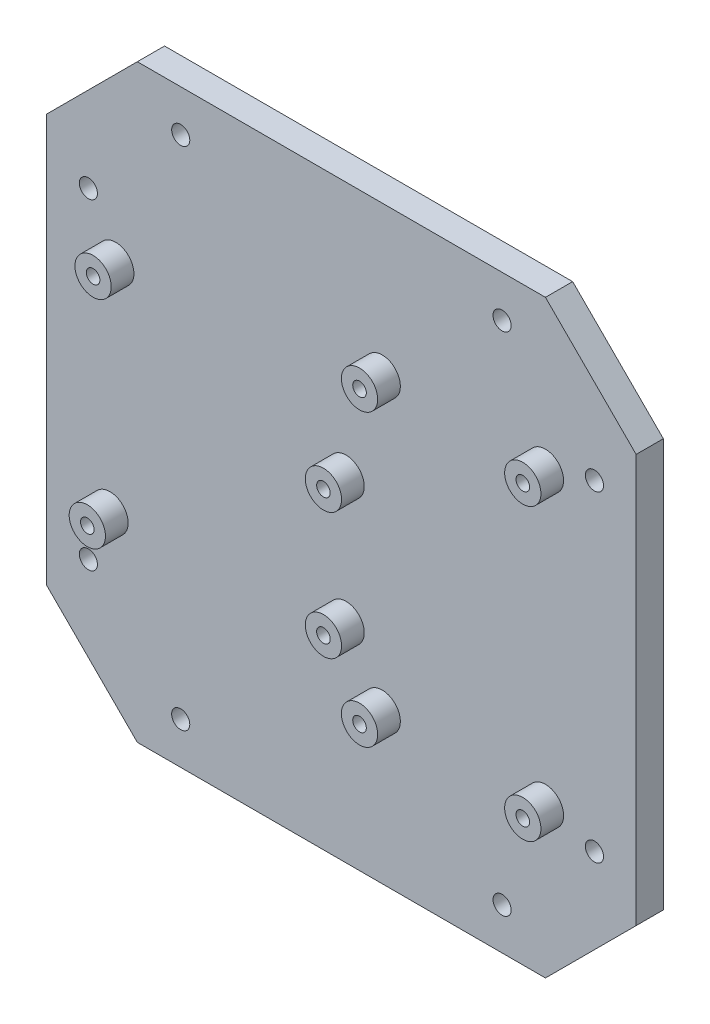
from build123d import *

# Parameters (mm, degrees)
SKETCH_1_W          = 130
SKETCH_1_H          = 130
EXTRUDE_1_DEPTH     = 6
SKETCH_10_R         = 1.5
CUT_EXTRUDE_1_DEPTH = 6
CUT_EXTRUDE_2_REACH = 185.946
SKETCH_11_R         = 2
CHAMFER_1_SIZE      = 20
CUT_EXTRUDE_3_REACH = 185.946
SKETCH_12_R         = 1.5
EXTRUDE_START       = 5
SKETCH_13_R         = 4
SKETCH_13_R_2       = 1.5
EXTRUDE_2_DEPTH     = 5


with BuildPart() as part:
    # 草圖1 → 填料-伸長1 (new body)
    with BuildSketch(Plane.XY):
        with Locations((-65, 65)):
            Rectangle(SKETCH_1_W, SKETCH_1_H)
    extrude(amount=EXTRUDE_1_DEPTH)

    # 草圖10 → 除料-伸長1 (cut)
    with BuildSketch(Plane.XY.offset(6)):
        with Locations((-114.76, 89.13)):
            Circle(SKETCH_10_R)
        with Locations((-63.96, 73.89)):
            Circle(SKETCH_10_R)
        with Locations((-63.96, 45.95)):
            Circle(SKETCH_10_R)
        with Locations((-116.03, 40.87)):
            Circle(SKETCH_10_R)
    extrude(amount=-CUT_EXTRUDE_1_DEPTH, mode=Mode.SUBTRACT)

    # 草圖11 → 除料-伸長2 (cut, up to next)
    with BuildSketch(Plane.XY.offset(6), mode=Mode.PRIVATE) as cut_extrude_2_sk1:
        with Locations((-9.2, 100.435324702)):
            Circle(SKETCH_11_R)
    cut_extrude_2_tool1 = extrude(cut_extrude_2_sk1.sketch, amount=-CUT_EXTRUDE_2_REACH, mode=Mode.PRIVATE) & part.part
    # 草圖11 → 除料-伸長2 (cut, up to next)
    with BuildSketch(Plane.XY.offset(6), mode=Mode.PRIVATE) as cut_extrude_2_sk2:
        with Locations((-29.564675298, 120.8)):
            Circle(SKETCH_11_R)
    cut_extrude_2_tool2 = extrude(cut_extrude_2_sk2.sketch, amount=-CUT_EXTRUDE_2_REACH, mode=Mode.PRIVATE) & part.part
    # 草圖11 → 除料-伸長2 (cut, up to next)
    with BuildSketch(Plane.XY.offset(6), mode=Mode.PRIVATE) as cut_extrude_2_sk3:
        with Locations((-100.435324702, 120.8)):
            Circle(SKETCH_11_R)
    cut_extrude_2_tool3 = extrude(cut_extrude_2_sk3.sketch, amount=-CUT_EXTRUDE_2_REACH, mode=Mode.PRIVATE) & part.part
    # 草圖11 → 除料-伸長2 (cut, up to next)
    with BuildSketch(Plane.XY.offset(6), mode=Mode.PRIVATE) as cut_extrude_2_sk4:
        with Locations((-120.8, 100.435324702)):
            Circle(SKETCH_11_R)
    cut_extrude_2_tool4 = extrude(cut_extrude_2_sk4.sketch, amount=-CUT_EXTRUDE_2_REACH, mode=Mode.PRIVATE) & part.part
    # 草圖11 → 除料-伸長2 (cut, up to next)
    with BuildSketch(Plane.XY.offset(6), mode=Mode.PRIVATE) as cut_extrude_2_sk5:
        with Locations((-120.8, 29.564675298)):
            Circle(SKETCH_11_R)
    cut_extrude_2_tool5 = extrude(cut_extrude_2_sk5.sketch, amount=-CUT_EXTRUDE_2_REACH, mode=Mode.PRIVATE) & part.part
    # 草圖11 → 除料-伸長2 (cut, up to next)
    with BuildSketch(Plane.XY.offset(6), mode=Mode.PRIVATE) as cut_extrude_2_sk6:
        with Locations((-100.435324702, 9.2)):
            Circle(SKETCH_11_R)
    cut_extrude_2_tool6 = extrude(cut_extrude_2_sk6.sketch, amount=-CUT_EXTRUDE_2_REACH, mode=Mode.PRIVATE) & part.part
    # 草圖11 → 除料-伸長2 (cut, up to next)
    with BuildSketch(Plane.XY.offset(6), mode=Mode.PRIVATE) as cut_extrude_2_sk7:
        with Locations((-29.564675298, 9.2)):
            Circle(SKETCH_11_R)
    cut_extrude_2_tool7 = extrude(cut_extrude_2_sk7.sketch, amount=-CUT_EXTRUDE_2_REACH, mode=Mode.PRIVATE) & part.part
    # 草圖11 → 除料-伸長2 (cut, up to next)
    with BuildSketch(Plane.XY.offset(6), mode=Mode.PRIVATE) as cut_extrude_2_sk8:
        with Locations((-9.2, 29.564675298)):
            Circle(SKETCH_11_R)
    cut_extrude_2_tool8 = extrude(cut_extrude_2_sk8.sketch, amount=-CUT_EXTRUDE_2_REACH, mode=Mode.PRIVATE) & part.part
    add(cut_extrude_2_tool1.solids().sort_by_distance((-9.2, 100.435325, 6))[0], mode=Mode.SUBTRACT)
    add(cut_extrude_2_tool2.solids().sort_by_distance((-29.564675, 120.8, 6))[0], mode=Mode.SUBTRACT)
    add(cut_extrude_2_tool3.solids().sort_by_distance((-100.435325, 120.8, 6))[0], mode=Mode.SUBTRACT)
    add(cut_extrude_2_tool4.solids().sort_by_distance((-120.8, 100.435325, 6))[0], mode=Mode.SUBTRACT)
    add(cut_extrude_2_tool5.solids().sort_by_distance((-120.8, 29.564675, 6))[0], mode=Mode.SUBTRACT)
    add(cut_extrude_2_tool6.solids().sort_by_distance((-100.435325, 9.2, 6))[0], mode=Mode.SUBTRACT)
    add(cut_extrude_2_tool7.solids().sort_by_distance((-29.564675, 9.2, 6))[0], mode=Mode.SUBTRACT)
    add(cut_extrude_2_tool8.solids().sort_by_distance((-9.2, 29.564675, 6))[0], mode=Mode.SUBTRACT)

    # 導角1
    chamfer_1_edges = [part.edges().sort_by_distance(p)[0] for p in [
        (-130, 0, 3),
        (-130, 130, 3),
        (0, 130, 3),
        (0, 0, 3),
    ]]
    chamfer(chamfer_1_edges, length=CHAMFER_1_SIZE)

    # 草圖12 → 除料-伸長3 (cut, up to next)
    with BuildSketch(Plane.XY.offset(6), mode=Mode.PRIVATE) as cut_extrude_3_sk1:
        with Locations((-56, 97)):
            Circle(SKETCH_12_R)
    cut_extrude_3_tool1 = extrude(cut_extrude_3_sk1.sketch, amount=-CUT_EXTRUDE_3_REACH, mode=Mode.PRIVATE) & part.part
    # 草圖12 → 除料-伸長3 (cut, up to next)
    with BuildSketch(Plane.XY.offset(6), mode=Mode.PRIVATE) as cut_extrude_3_sk2:
        with Locations((-20, 97)):
            Circle(SKETCH_12_R)
    cut_extrude_3_tool2 = extrude(cut_extrude_3_sk2.sketch, amount=-CUT_EXTRUDE_3_REACH, mode=Mode.PRIVATE) & part.part
    # 草圖12 → 除料-伸長3 (cut, up to next)
    with BuildSketch(Plane.XY.offset(6), mode=Mode.PRIVATE) as cut_extrude_3_sk3:
        with Locations((-56, 33)):
            Circle(SKETCH_12_R)
    cut_extrude_3_tool3 = extrude(cut_extrude_3_sk3.sketch, amount=-CUT_EXTRUDE_3_REACH, mode=Mode.PRIVATE) & part.part
    # 草圖12 → 除料-伸長3 (cut, up to next)
    with BuildSketch(Plane.XY.offset(6), mode=Mode.PRIVATE) as cut_extrude_3_sk4:
        with Locations((-20, 33)):
            Circle(SKETCH_12_R)
    cut_extrude_3_tool4 = extrude(cut_extrude_3_sk4.sketch, amount=-CUT_EXTRUDE_3_REACH, mode=Mode.PRIVATE) & part.part
    add(cut_extrude_3_tool1.solids().sort_by_distance((-56, 97, 6))[0], mode=Mode.SUBTRACT)
    add(cut_extrude_3_tool2.solids().sort_by_distance((-20, 97, 6))[0], mode=Mode.SUBTRACT)
    add(cut_extrude_3_tool3.solids().sort_by_distance((-56, 33, 6))[0], mode=Mode.SUBTRACT)
    add(cut_extrude_3_tool4.solids().sort_by_distance((-20, 33, 6))[0], mode=Mode.SUBTRACT)

    # 草圖13 → 填料-伸長2 (add)
    # profile 1 of 8: a face of its own
    with BuildSketch(Plane.XY.offset(6).offset(EXTRUDE_START)):
        with Locations((-114.76, 89.13)):
            Circle(SKETCH_13_R)
        with Locations((-114.76, 89.13)):
            Circle(SKETCH_13_R_2, mode=Mode.SUBTRACT)
    # profile 2 of 8: a face of its own
    with BuildSketch(Plane.XY.offset(6).offset(EXTRUDE_START)):
        with Locations((-56, 97)):
            Circle(SKETCH_13_R)
        with Locations((-56, 97)):
            Circle(SKETCH_13_R_2, mode=Mode.SUBTRACT)
    # profile 3 of 8: a face of its own
    with BuildSketch(Plane.XY.offset(6).offset(EXTRUDE_START)):
        with Locations((-116.03, 40.87)):
            Circle(SKETCH_13_R)
        with Locations((-116.03, 40.87)):
            Circle(SKETCH_13_R_2, mode=Mode.SUBTRACT)
    # profile 4 of 8: a face of its own
    with BuildSketch(Plane.XY.offset(6).offset(EXTRUDE_START)):
        with Locations((-63.96, 73.89)):
            Circle(SKETCH_13_R)
        with Locations((-63.96, 73.89)):
            Circle(SKETCH_13_R_2, mode=Mode.SUBTRACT)
    # profile 5 of 8: a face of its own
    with BuildSketch(Plane.XY.offset(6).offset(EXTRUDE_START)):
        with Locations((-63.96, 45.95)):
            Circle(SKETCH_13_R)
        with Locations((-63.96, 45.95)):
            Circle(SKETCH_13_R_2, mode=Mode.SUBTRACT)
    # profile 6 of 8: a face of its own
    with BuildSketch(Plane.XY.offset(6).offset(EXTRUDE_START)):
        with Locations((-56, 33)):
            Circle(SKETCH_13_R)
        with Locations((-56, 33)):
            Circle(SKETCH_13_R_2, mode=Mode.SUBTRACT)
    # profile 7 of 8: a face of its own
    with BuildSketch(Plane.XY.offset(6).offset(EXTRUDE_START)):
        with Locations((-20, 33)):
            Circle(SKETCH_13_R)
        with Locations((-20, 33)):
            Circle(SKETCH_13_R_2, mode=Mode.SUBTRACT)
    # profile 8 of 8: a face of its own
    with BuildSketch(Plane.XY.offset(6).offset(EXTRUDE_START)):
        with Locations((-20, 97)):
            Circle(SKETCH_13_R)
        with Locations((-20, 97)):
            Circle(SKETCH_13_R_2, mode=Mode.SUBTRACT)
    extrude(amount=-EXTRUDE_2_DEPTH)


solid = part.part
